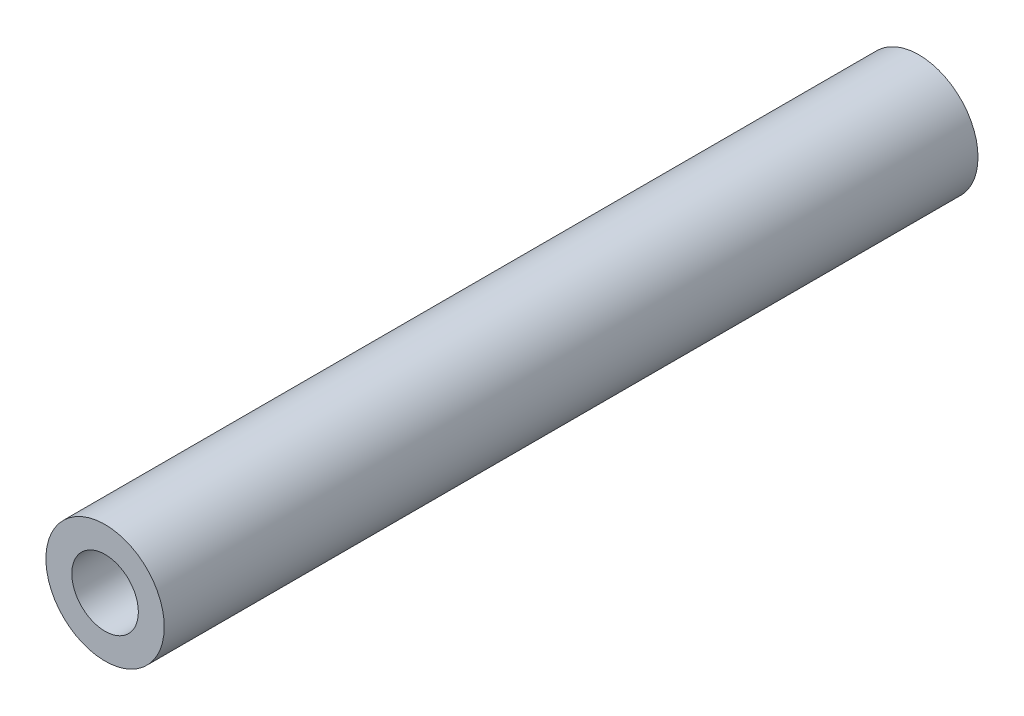
from build123d import *

# Parameters (mm, degrees)
TIE_TUBE_START = -27
SKETCH_1_R     = 4
SKETCH_1_R_2   = 2.25
TIE_TUBE_DEPTH = 55


with BuildPart() as part:
    # Эскиз1 → Tie_tube (new body)
    with BuildSketch(Plane.XY.offset(TIE_TUBE_START)):
        Circle(SKETCH_1_R)
        Circle(SKETCH_1_R_2, mode=Mode.SUBTRACT)
    extrude(amount=TIE_TUBE_DEPTH)


solid = part.part
